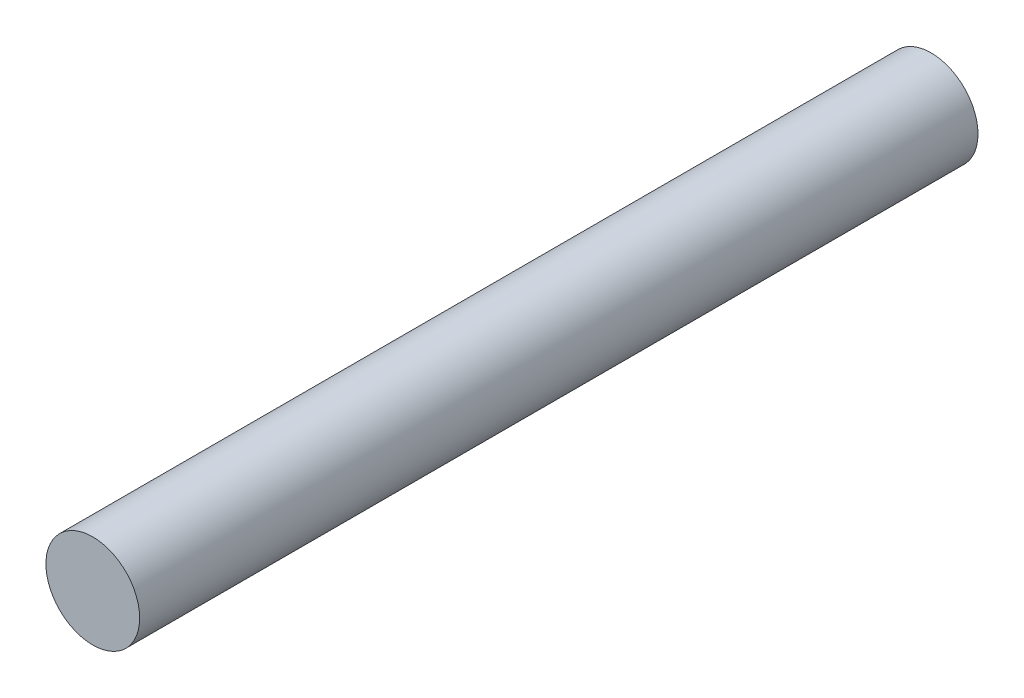
from build123d import *

# Parameters (mm, degrees)
SKETCH1_R           = 9.017
BOSS_EXTRUDE1_DEPTH = 161.29


with BuildPart() as part:
    # Sketch1 → Boss-Extrude1 (new body)
    with BuildSketch(Plane.XY):
        Circle(SKETCH1_R)
    extrude(amount=BOSS_EXTRUDE1_DEPTH)


solid = part.part
